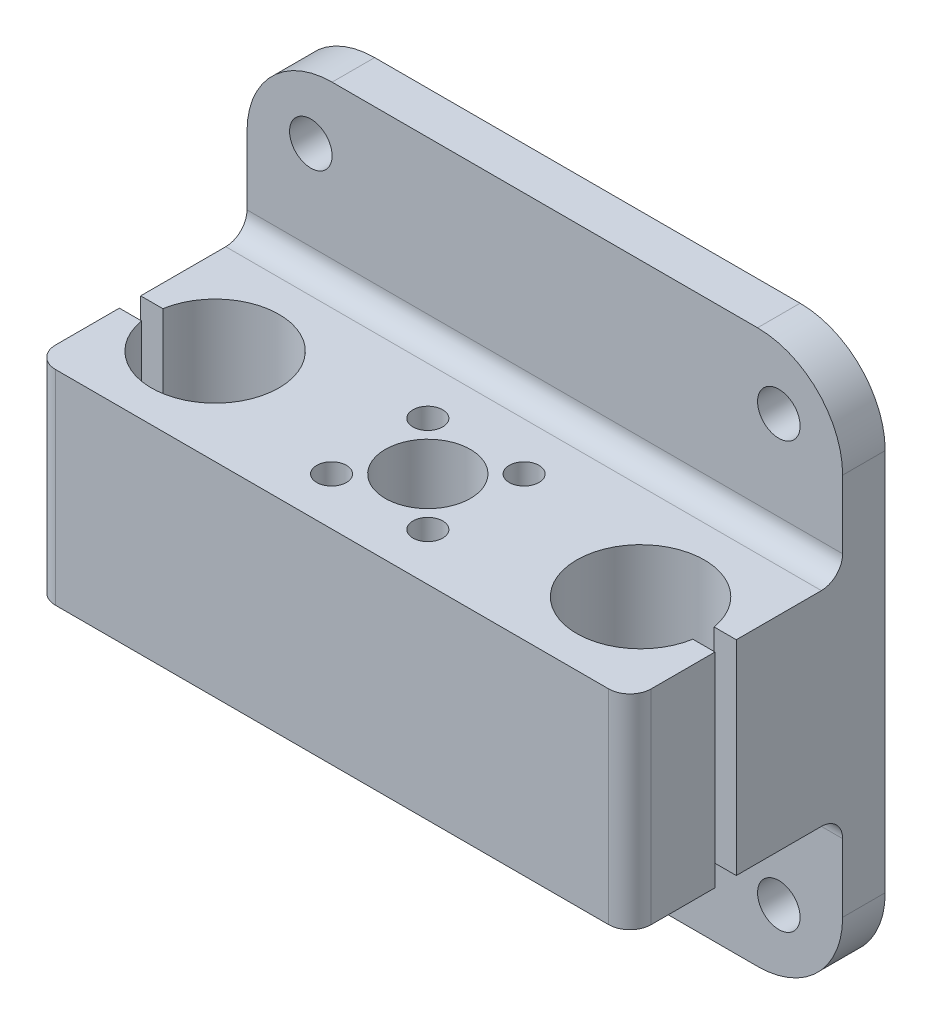
from build123d import *

# Parameters (mm, degrees)
SKETCH1_W           = 70
SKETCH1_H           = 65
SKETCH1_R           = 2.5
BOSS_EXTRUDE1_DEPTH = 5
FILLET1_R           = 10
SKETCH2_W           = 70
SKETCH2_H           = 24
BOSS_EXTRUDE2_DEPTH = 25
FILLET2_R           = 2.5
SKETCH3_R           = 5
SKETCH3_R_2         = 7.5
CUT_EXTRUDE1_DEPTH  = 30
SKETCH4_R           = 1.75
CUT_EXTRUDE2_DEPTH  = 30
FILLET3_R           = 2.5
SKETCH6_W           = 8.533797122
SKETCH6_H           = 2.5
SKETCH6_W_2         = 12.888873946
CUT_EXTRUDE3_DEPTH  = 30


with BuildPart() as part:
    # Sketch1 → Boss-Extrude1 (new body)
    with BuildSketch(Plane.XY):
        with Locations((-15.487804878, -14.329268293)):
            Rectangle(SKETCH1_W, SKETCH1_H)
        with Locations((-42.987804878, 10.670731707)):
            Circle(SKETCH1_R, mode=Mode.SUBTRACT)
        with Locations((12.012195122, 10.670731707)):
            Circle(SKETCH1_R, mode=Mode.SUBTRACT)
        with Locations((-42.987804878, -39.329268293)):
            Circle(SKETCH1_R, mode=Mode.SUBTRACT)
        with Locations((12.012195122, -39.329268293)):
            Circle(SKETCH1_R, mode=Mode.SUBTRACT)
    extrude(amount=BOSS_EXTRUDE1_DEPTH)

    # Fillet1
    fillet1_edges = [part.edges().sort_by_distance(p)[0] for p in [
        (-50.487804878, 18.170731707, 2.5),
        (19.512195122, 18.170731707, 2.5),
        (19.512195122, -46.829268293, 2.5),
        (-50.487804878, -46.829268293, 2.5),
    ]]
    fillet(fillet1_edges, radius=FILLET1_R)

    # Sketch2 → Boss-Extrude2 (add)
    with BuildSketch(Plane.XY.offset(5)):
        with Locations((-15.487804878, -14.329268293)):
            Rectangle(SKETCH2_W, SKETCH2_H)
    extrude(amount=BOSS_EXTRUDE2_DEPTH)

    # Fillet2
    fillet2_edges = [part.edges().sort_by_distance(p)[0] for p in [
        (-15.487804878, -26.329268293, 5),
        (-15.487804878, -2.329268293, 5),
    ]]
    fillet(fillet2_edges, radius=FILLET2_R)

    # Sketch3 → Cut-Extrude1 (cut)
    with BuildSketch(Plane(origin=(0, -2.329268293, 0), x_dir=(1, 0, 0), z_dir=(0, 1, 0))):
        with Locations(Location((-15.487804878, -18.75, 0), (0, 0, 180))):
            Circle(SKETCH3_R)
        with Locations(Location((-40.487804878, -18.75, 0), (0, 0, 180))):
            Circle(SKETCH3_R_2)
        with Locations(Location((9.512195122, -18.75, 0), (0, 0, 180))):
            Circle(SKETCH3_R_2)
    extrude(amount=-CUT_EXTRUDE1_DEPTH, mode=Mode.SUBTRACT)

    # Sketch4 → Cut-Extrude2 (cut)
    with BuildSketch(Plane(origin=(0, -2.329268293, 0), x_dir=(1, 0, 0), z_dir=(0, 1, 0))):
        with Locations(Location((-21.144659128, -13.093145751, 0), (0, 0, 180))):
            Circle(SKETCH4_R)
        with Locations(Location((-9.830950629, -13.093145751, 0), (0, 0, 180))):
            Circle(SKETCH4_R)
        with Locations(Location((-9.830950629, -24.406854249, 0), (0, 0, 180))):
            Circle(SKETCH4_R)
        with Locations(Location((-21.144659128, -24.406854249, 0), (0, 0, 180))):
            Circle(SKETCH4_R)
    extrude(amount=-CUT_EXTRUDE2_DEPTH, mode=Mode.SUBTRACT)

    # Fillet3
    fillet3_edges = [part.edges().sort_by_distance(p)[0] for p in [
        (-50.487804878, -14.329268293, 30),
        (19.512195122, -14.329268293, 30),
    ]]
    fillet(fillet3_edges, radius=FILLET3_R)

    # Sketch6 → Cut-Extrude3 (cut)
    with BuildSketch(Plane(origin=(0, -2.329268293, 0), x_dir=(1, 0, 0), z_dir=(0, 1, 0))):
        with Locations((-47.987804878, -18.75)):
            Rectangle(SKETCH6_W, SKETCH6_H)
        with Locations((17.012195122, -18.75)):
            Rectangle(SKETCH6_W_2, SKETCH6_H)
    extrude(amount=-CUT_EXTRUDE3_DEPTH, mode=Mode.SUBTRACT)


solid = part.part
